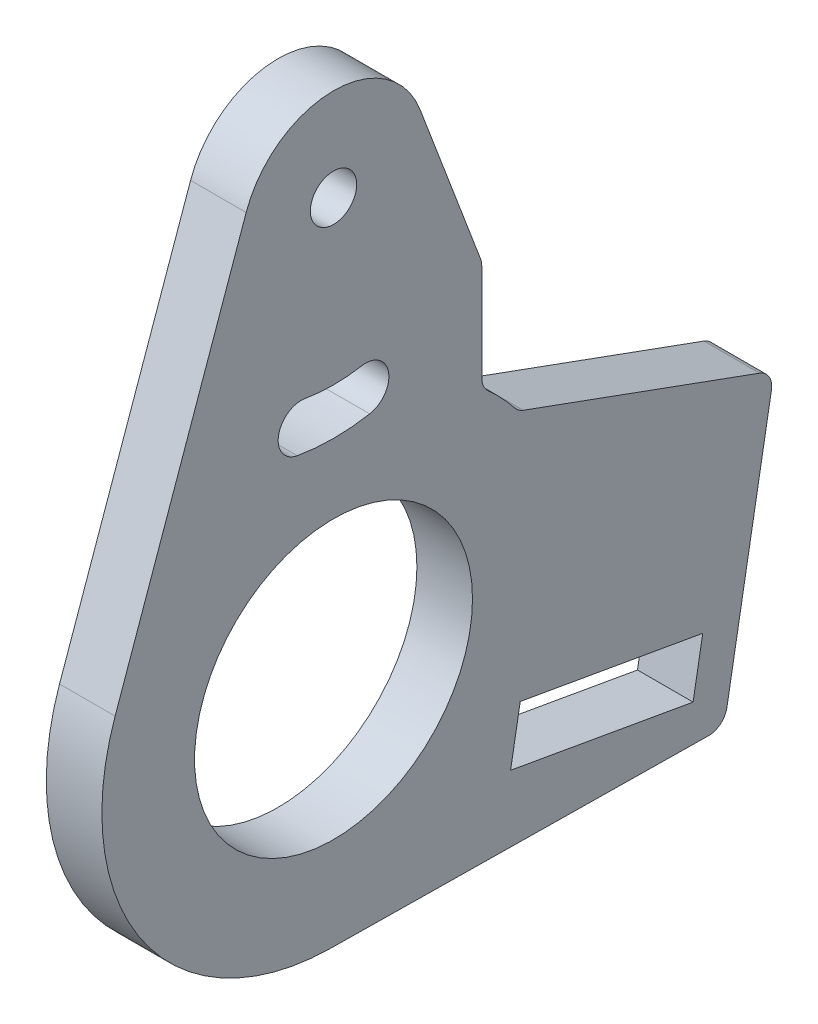
from build123d import *

# Parameters (mm, degrees)
SKETCH1_R           = 15
SKETCH1_R_2         = 2.5
BOSS_EXTRUDE1_DEPTH = 6
FILLET1_R           = 2


with BuildPart() as part:
    # Sketch1 → Boss-Extrude1 (new body)
    with BuildSketch(Plane(origin=(0, 0, 0), x_dir=(0, 0, -1), z_dir=(1, 0, 0))):
        with BuildLine():
            Line((-59.428090416, 18.333333333), (-73.57022604, -21.666666667))
            ThreePointArc((-73.57022604, -21.666666667), (-70.504972651, -44.301961285), (-50.322091296, -54.997925058))
            Line((-50.322091296, -54.997925058), (-7.837413011, -55.545328295))
            Line((-7.837413011, -55.545328295), (-2.444575303, -24.961025846))
            Line((-2.444575303, -24.961025846), (-30.070966116, -14.905841909))
            ThreePointArc((-30.070966116, -14.905841909), (-31.918030616, -12.736095946), (-34, -10.790627288))
            Line((-34, -10.790627288), (-34, 1))
            Line((-34, 1), (-40.649042421, 18.543951518))
            ThreePointArc((-40.649042421, 18.543951518), (-50.11214889, 24.999371112), (-59.428090416, 18.333333333))
        make_face()
        with Locations((-50, -30)):
            Circle(SKETCH1_R, mode=Mode.SUBTRACT)
        with Locations((-50, 15)):
            Circle(SKETCH1_R_2, mode=Mode.SUBTRACT)
        Polygon((-29.84807753, -42.163518223), (-10.15192247, -45.636481777), (-11.193811536, -51.545328295), (-30.889966596, -48.072364741), align=None, mode=Mode.SUBTRACT)
        with BuildLine():
            ThreePointArc((-53.038843109, -2.234135678), (-55.934982936, -4.262034616), (-53.907083998, -7.158174443))
            ThreePointArc((-53.907083998, -7.158174443), (-50, -7.5), (-46.092916002, -7.158174443))
            ThreePointArc((-46.092916002, -7.158174443), (-44.065017064, -4.262034616), (-46.961156891, -2.234135678))
            ThreePointArc((-46.961156891, -2.234135678), (-50, -2.5), (-53.038843109, -2.234135678))
        make_face(mode=Mode.SUBTRACT)
    extrude(amount=BOSS_EXTRUDE1_DEPTH)

    # Fillet1
    fillet1_edges = [part.edges().sort_by_distance(p)[0] for p in [
        (3, -14.905841909, 30.070966116),
        (3, -24.961025846, 2.444575303),
        (3, -55.545328295, 7.837413011),
        (3, 1, 34),
        (3, -10.790627288, 34),
    ]]
    fillet(fillet1_edges, radius=FILLET1_R)


solid = part.part
